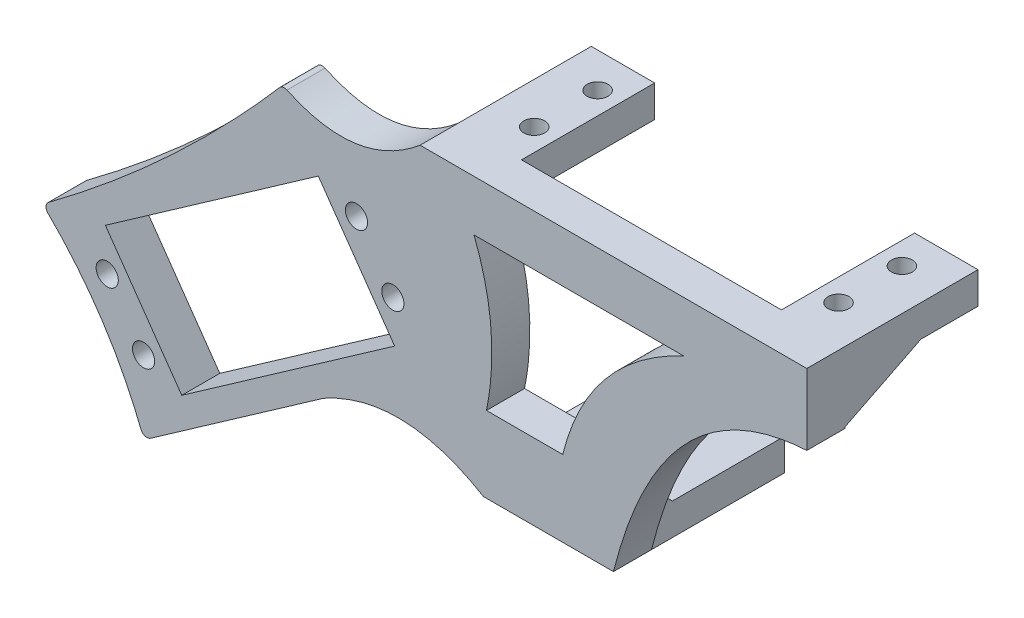
from build123d import *

# Parameters (mm, degrees)
SKETCH1_W             = 10
SKETCH1_H             = 5
BOSS_EXTRUDE1_DEPTH   = 21
BOSS_EXTRUDE1_2_DEPTH = 21
BOSS_EXTRUDE2_DEPTH   = 6
SKETCH3_W             = 20.5
SKETCH3_H             = 5
BOSS_EXTRUDE3_DEPTH   = 21
CUT_EXTRUDE1_REACH    = 64.414
SKETCH4_R             = 1.65
CUT_EXTRUDE2_REACH    = 61.08
SKETCH5_R             = 2.2
SKETCH6_R             = 1.75
BOSS_EXTRUDE4_DEPTH   = 6
CUT_EXTRUDE3_REACH    = 107.857
CUT_EXTRUDE7_REACH    = 109.208
BOSS_EXTRUDE5_DEPTH   = 6
BOSS_EXTRUDE6_DEPTH   = 3
BOSS_EXTRUDE7_DEPTH   = 3
BOSS_EXTRUDE8_DEPTH   = 20.5
CUT_EXTRUDE9_DEPTH    = 6
FILLET1_R             = 1
CUT_EXTRUDE10_DEPTH   = 2


with BuildPart() as part:
    # Sketch1 → Boss-Extrude1 (new body)
    with BuildSketch(Plane.XY):
        with Locations((-31.296703297, 19.79010989)):
            Rectangle(SKETCH1_W, SKETCH1_H)
    extrude(amount=BOSS_EXTRUDE1_DEPTH)



with BuildPart() as body_2:
    # Sketch1 → Boss-Extrude1 2 (new body)
    with BuildSketch(Plane.XY):
        with Locations((19.703296703, 19.79010989)):
            Rectangle(SKETCH1_W, SKETCH1_H)
    extrude(amount=BOSS_EXTRUDE1_2_DEPTH)


with BuildPart() as part_1:
    add(part.part)

    add(body_2.part)  # Boss-Extrude2 merges body 2
    # Sketch2 → Boss-Extrude2 (add)
    with BuildSketch(Plane.XY.offset(21)):
        Polygon((-36.296703297, 22.29010989), (24.703296703, 22.29010989), (24.703296703, 7.29010989), (12.703296703, 7.29010989), (-5.796703297, -11.20989011), (-5.796703297, -20.70989011), (-36.296703297, -20.70989011), align=None)
    extrude(amount=BOSS_EXTRUDE2_DEPTH)

    # Sketch3 → Boss-Extrude3 (add)
    with BuildSketch(Plane(origin=(0, 0, 21), x_dir=(-1, 0, 0), z_dir=(0, 0, -1))):
        with Locations((16.046703297, -18.20989011)):
            Rectangle(SKETCH3_W, SKETCH3_H)
    extrude(amount=BOSS_EXTRUDE3_DEPTH)

    # Sketch4 → Cut-Extrude1 (cut, up to next)
    with BuildSketch(Plane(origin=(0, 22.29010989, 0), x_dir=(1, 0, 0), z_dir=(0, 1, 0)), mode=Mode.PRIVATE) as cut_extrude1_sk1:
        with Locations(Location((-29.796703297, -5.5, 0), (0, 0, 270))):
            Circle(SKETCH4_R)
    cut_extrude1_tool1 = extrude(cut_extrude1_sk1.sketch, amount=-CUT_EXTRUDE1_REACH, mode=Mode.PRIVATE) & part_1.part
    # Sketch4 → Cut-Extrude1 (cut, up to next)
    with BuildSketch(Plane(origin=(0, 22.29010989, 0), x_dir=(1, 0, 0), z_dir=(0, 1, 0)), mode=Mode.PRIVATE) as cut_extrude1_sk2:
        with Locations(Location((18.203296703, -5.5, 0), (0, 0, 270))):
            Circle(SKETCH4_R)
    cut_extrude1_tool2 = extrude(cut_extrude1_sk2.sketch, amount=-CUT_EXTRUDE1_REACH, mode=Mode.PRIVATE) & part_1.part
    # Sketch4 → Cut-Extrude1 (cut, up to next)
    with BuildSketch(Plane(origin=(0, 22.29010989, 0), x_dir=(1, 0, 0), z_dir=(0, 1, 0)), mode=Mode.PRIVATE) as cut_extrude1_sk3:
        with Locations(Location((18.203296703, -15.5, 0), (0, 0, 270))):
            Circle(SKETCH4_R)
    cut_extrude1_tool3 = extrude(cut_extrude1_sk3.sketch, amount=-CUT_EXTRUDE1_REACH, mode=Mode.PRIVATE) & part_1.part
    # Sketch4 → Cut-Extrude1 (cut, up to next)
    with BuildSketch(Plane(origin=(0, 22.29010989, 0), x_dir=(1, 0, 0), z_dir=(0, 1, 0)), mode=Mode.PRIVATE) as cut_extrude1_sk4:
        with Locations(Location((-29.796703297, -15.5, 0), (0, 0, 270))):
            Circle(SKETCH4_R)
    cut_extrude1_tool4 = extrude(cut_extrude1_sk4.sketch, amount=-CUT_EXTRUDE1_REACH, mode=Mode.PRIVATE) & part_1.part
    add(cut_extrude1_tool1.solids().sort_by_distance((-29.796703, 22.29011, 5.5))[0], mode=Mode.SUBTRACT)
    add(cut_extrude1_tool2.solids().sort_by_distance((18.203297, 22.29011, 5.5))[0], mode=Mode.SUBTRACT)
    add(cut_extrude1_tool3.solids().sort_by_distance((18.203297, 22.29011, 15.5))[0], mode=Mode.SUBTRACT)
    add(cut_extrude1_tool4.solids().sort_by_distance((-29.796703, 22.29011, 15.5))[0], mode=Mode.SUBTRACT)

    # Sketch5 → Cut-Extrude2 (cut, up to next)
    with BuildSketch(Plane(origin=(0, -15.70989011, 0), x_dir=(1, 0, 0), z_dir=(0, 1, 0)), mode=Mode.PRIVATE) as cut_extrude2_sk1:
        with Locations(Location((-16.046703297, -10.5, 0), (0, 0, 270))):
            Circle(SKETCH5_R)
    cut_extrude2_tool1 = extrude(cut_extrude2_sk1.sketch, amount=-CUT_EXTRUDE2_REACH, mode=Mode.PRIVATE) & part_1.part
    add(cut_extrude2_tool1.solids().sort_by_distance((-16.046703, -15.70989, 10.5))[0], mode=Mode.SUBTRACT)

    # Sketch6 → Boss-Extrude4 (add)
    with BuildSketch(Plane.XY.offset(27)):
        with BuildLine():
            Line((-79.859138265, -39.735236509), (-51.503727763, -19.880564327))
            add(Edge.make_bspline(
                [(-51.503727763, -19.880564327), (-43.777944292, -18.491061957), (-36.296703297, -20.70989011)],
                knots=[0, 0, 0, 1, 1, 1], degree=2))
            Line((-36.296703297, -20.70989011), (-36.296703297, 22.29010989))
            add(Edge.make_bspline(
                [(-57.962836939, 19.661219133), (-46.447122218, 13.814864777), (-36.296703297, 22.29010989)],
                knots=[0, 0, 0, 1, 1, 1], degree=2))
            add(Edge.make_bspline(
                [(-95.842115451, -15.524174544), (-74.909238175, -0.080881368), (-57.962836939, 19.661219133)],
                knots=[0, 0, 0, 1, 1, 1], degree=2))
            add(Edge.make_bspline(
                [(-95.842115451, -15.524174544), (-85.086697095, -25.754599345), (-79.859138265, -39.735236509)],
                knots=[0, 0, 0, 1, 1, 1], degree=2))
        make_face()
        with Locations((-40.590214383, -0.641481396)):
            Circle(SKETCH6_R, mode=Mode.SUBTRACT)
        with Locations((-85.645276872, -19.981629898)):
            Circle(SKETCH6_R, mode=Mode.SUBTRACT)
        with Locations((-79.909512508, -28.173150341)):
            Circle(SKETCH6_R, mode=Mode.SUBTRACT)
        with Locations((-46.325978746, 7.550039047)):
            Circle(SKETCH6_R, mode=Mode.SUBTRACT)
        Polygon((-85.932915117, -13.468776127), (-52.347681301, 10.047857763), (-40.302576138, -7.154335167), (-73.887809953, -30.670969058), align=None, mode=Mode.SUBTRACT)
    extrude(amount=-BOSS_EXTRUDE4_DEPTH)

    # Sketch7 → Cut-Extrude3 (cut, up to next)
    with BuildSketch(Plane(origin=(0, 0, 21), x_dir=(-1, 0, 0), z_dir=(0, 0, -1)), mode=Mode.PRIVATE) as cut_extrude3_sk1:
        with BuildLine():
            Line((36.296703297, -20.70989011), (26.296703297, -20.70989011))
            add(Edge.make_bspline(
                [(26.296703297, -20.70989011), (39.15974316, -13.056772406), (51.503727763, -19.880564327)],
                knots=[0, 0, 0, 1, 1, 1], degree=2))
            add(Edge.make_bspline(
                [(51.503727763, -19.880564327), (43.777944292, -18.491061957), (36.296703297, -20.70989011)],
                knots=[0, 0, 0, 1, 1, 1], degree=2))
        make_face()
    cut_extrude3_tool1 = extrude(cut_extrude3_sk1.sketch, amount=-CUT_EXTRUDE3_REACH, mode=Mode.PRIVATE) & part_1.part
    add(cut_extrude3_tool1.solids().sort_by_distance((-38.072503, -18.786508, 21))[0], mode=Mode.SUBTRACT)

    # Sketch10 → Cut-Extrude7 (cut, up to next)
    with BuildSketch(Plane.XY.offset(27), mode=Mode.PRIVATE) as cut_extrude7_sk1:
        with BuildLine():
            Line((5.266834936, 14.29010989), (-27.788194587, 14.29010989))
            add(Edge.make_bspline(
                [(-27.788194587, 14.29010989), (-23.431396766, 3.132914333), (-25.823714091, -8.70989011)],
                knots=[0, 0, 0, 1, 1, 1], degree=2))
            Line((-25.823714091, -8.70989011), (-13.796703297, -8.70989011))
            add(Edge.make_bspline(
                [(5.266834936, 14.29010989), (-9.842167425, 7.185288479), (-13.796703297, -8.70989011)],
                knots=[0, 0, 0, 1, 1, 1], degree=2))
        make_face()
    cut_extrude7_tool1 = extrude(cut_extrude7_sk1.sketch, amount=-CUT_EXTRUDE7_REACH, mode=Mode.PRIVATE) & part_1.part
    add(cut_extrude7_tool1.solids().sort_by_distance((-15.764918, 4.836925, 27))[0], mode=Mode.SUBTRACT)

    # Sketch11 → Boss-Extrude5 (add)
    with BuildSketch(Plane.XY.offset(27)):
        with BuildLine():
            Line((15.119169314, 7.29010989), (12.703296703, 7.29010989))
            Line((12.703296703, 7.29010989), (-5.796703297, -11.20989011))
            Line((-5.796703297, -11.20989011), (-5.796703297, -20.70989011))
            add(Edge.make_bspline(
                [(-5.796703297, -20.70989011), (-0.06692684, -3.022661062), (15.119169314, 7.29010989)],
                knots=[0, 0, 0, 1, 1, 1], degree=2))
        make_face()
    extrude(amount=-BOSS_EXTRUDE5_DEPTH)

    # Sketch12 → Boss-Extrude6 (add)
    with BuildSketch(Plane(origin=(24.703296703, 0, 0), x_dir=(0, 0, -1), z_dir=(1, 0, 0))):
        Polygon((-21, 11.29010989), (-9, 17.29010989), (-21, 17.29010989), align=None)
    extrude(amount=-BOSS_EXTRUDE6_DEPTH)

    # Sketch13 → Boss-Extrude7 (add)
    with BuildSketch(Plane.ZY.offset(36.296703297)):
        Polygon((21, 11.29010989), (21, 17.29010989), (9, 17.29010989), align=None)
    extrude(amount=-BOSS_EXTRUDE7_DEPTH)

    # Sketch14 → Boss-Extrude8 (add)
    with BuildSketch(Plane(origin=(-5.796703297, 0, 0), x_dir=(0, 0, -1), z_dir=(1, 0, 0))):
        Polygon((-17.7, -15.70989011), (-21, -12.40989011), (-21, -15.70989011), align=None)
    extrude(amount=-BOSS_EXTRUDE8_DEPTH)

    # Sketch15 → Cut-Extrude9 (cut)
    with BuildSketch(Plane.XY.offset(27)):
        with BuildLine():
            Line((24.703296703, 7.29010989), (24.703296703, 11.09010989))
            add(Edge.make_bspline(
                [(-5.796703297, -20.70989011), (1.890928929, 9.845343686), (24.703296703, 11.09010989)],
                knots=[0, 0, 0, 1, 1, 1], degree=2))
            add(Edge.make_bspline(
                [(-5.796703297, -20.70989011), (-0.06692684, -3.022661062), (15.119169314, 7.29010989)],
                knots=[0, 0, 0, 1, 1, 1], degree=2))
            Line((15.119169314, 7.29010989), (24.703296703, 7.29010989))
        make_face()
    extrude(amount=-CUT_EXTRUDE9_DEPTH, mode=Mode.SUBTRACT)

    # Fillet1
    fillet1_edges = [part_1.edges().sort_by_distance(p)[0] for p in [
        (-95.842115451, -15.524174544, 24),
        (-57.962836939, 19.661219133, 24),
        (-79.859138265, -39.735236509, 24),
    ]]
    fillet(fillet1_edges, radius=FILLET1_R)

    # Sketch16 → Cut-Extrude10 (cut)
    with BuildSketch(Plane(origin=(0, -15.70989011, 0), x_dir=(1, 0, 0), z_dir=(0, 1, 0))):
        Polygon((-13.910507301, -6.8), (-18.182899293, -6.8), (-20.319095289, -10.5), (-18.182899293, -14.2), (-13.910507301, -14.2), (-11.774311305, -10.5), align=None)
    extrude(amount=-CUT_EXTRUDE10_DEPTH, mode=Mode.SUBTRACT)


solid = part_1.part
